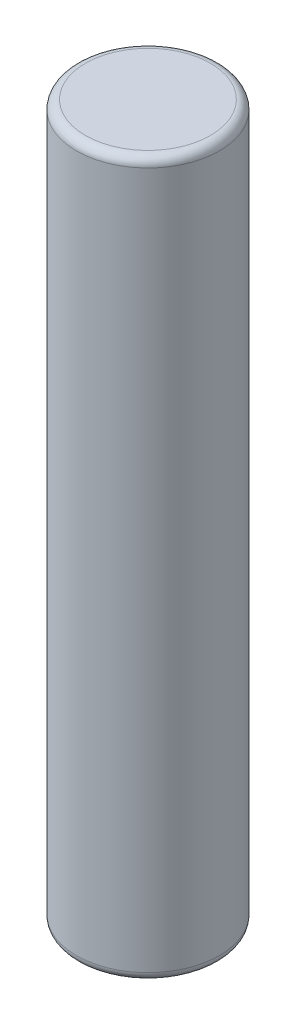
from build123d import *

# Parameters (mm, degrees)
SKETCH1_R           = 4
BOSS_EXTRUDE1_DEPTH = 40
FILLET1_R           = 0.5


with BuildPart() as part:
    # Sketch1 → Boss-Extrude1 (new body)
    with BuildSketch(Plane(origin=(0, 0, 0), x_dir=(1, 0, 0), z_dir=(0, 1, 0))):
        with Locations(Location((0, 0.71817143, 0), (0, 0, 270))):
            Circle(SKETCH1_R)
    extrude(amount=BOSS_EXTRUDE1_DEPTH)

    # Fillet1
    fillet1_edges = [part.edges().sort_by_distance(p)[0] for p in [
        (0, 0, -4.71817143),
        (0, 40, -4.71817143),
    ]]
    fillet(fillet1_edges, radius=FILLET1_R)


solid = part.part
